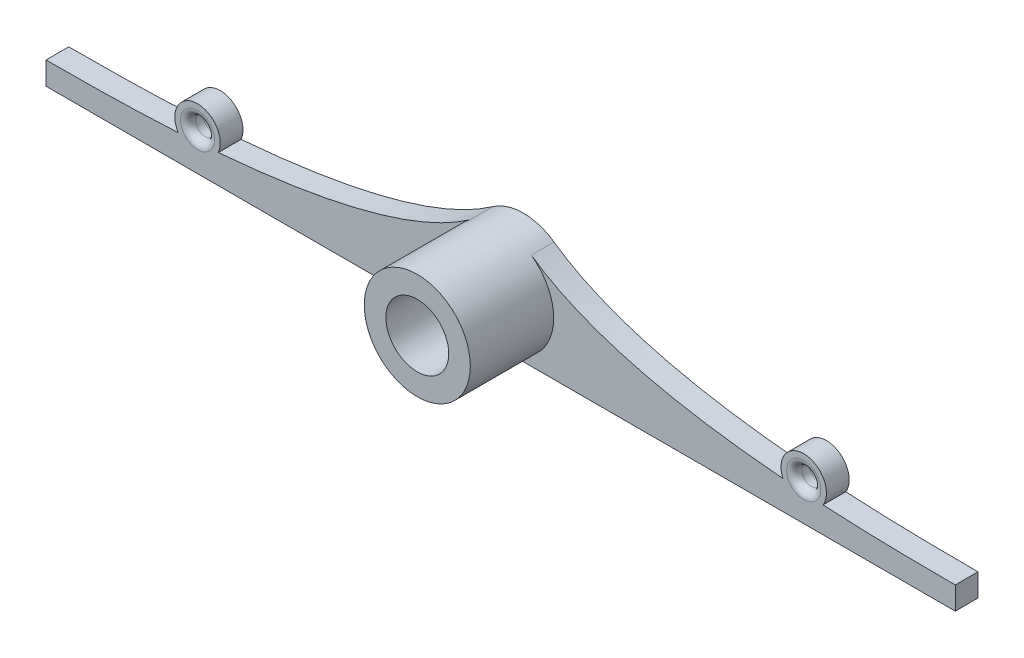
from build123d import *

# Parameters (mm, degrees)
SKETCH1_R             = 1.25
BOSS_EXTRUDE1_DEPTH   = 3
BOSS_EXTRUDE1_2_DEPTH = 3
SKETCH1_3_R           = 7
SKETCH1_3_R_2         = 4.15
BOSS_EXTRUDE2_DEPTH   = 14
FILLET1_R             = 1


with BuildPart() as part:
    # Sketch1 → Boss-Extrude1 (new body)
    with BuildSketch(Plane.XY):
        with BuildLine():
            Line((0, -7), (60, -7))
            Line((60, -7), (60, -4))
            add(Edge.make_bspline(
                [(60, -4), (55.163320485, -4), (49.053298786, -3.947636788), (42.55073288, -3.579164898)],
                knots=[0, 0, 0, 0, 0.318433517, 0.318433517, 0.318433517, 0.318433517], degree=3))
            ThreePointArc((42.55073288, -3.579164898), (40.208782774, 0.992726141), (37.254706676, -3.209696062))
            add(Edge.make_bspline(
                [(37.254706676, -3.209696062), (24.804076794, -2.167051335), (11.80488785, 0.231594042), (4.038655229, 5.717452574)],
                knots=[0.403779051, 0.403779051, 0.403779051, 0.403779051, 1, 1, 1, 1], degree=3))
            ThreePointArc((4.038655229, 5.717452574), (6.671662762, -2.118706207), (0, -7))
        make_face()
        with Locations((40, -2)):
            Circle(SKETCH1_R, mode=Mode.SUBTRACT)
    extrude(amount=BOSS_EXTRUDE1_DEPTH)



with BuildPart() as body_2:
    # Sketch1 → Boss-Extrude1 2 (new body)
    with BuildSketch(Plane.XY):
        with BuildLine():
            Line((-60, -7), (0, -7))
            ThreePointArc((0, -7), (-6.671662763, -2.118706204), (-4.038655225, 5.717452578))
            add(Edge.make_bspline(
                [(-37.254706671, -3.209696052), (-24.804076837, -2.16705132), (-11.80488784, 0.231594059), (-4.038655225, 5.717452578)],
                knots=[0.403779054, 0.403779054, 0.403779054, 0.403779054, 1, 1, 1, 1], degree=3))
            ThreePointArc((-37.254706671, -3.209696052), (-40.208782776, 0.992726141), (-42.550732884, -3.579164892))
            add(Edge.make_bspline(
                [(-60, -4), (-55.163320586, -4), (-49.053298864, -3.94763679), (-42.550732884, -3.579164892)],
                knots=[0, 0, 0, 0, 0.31843352, 0.31843352, 0.31843352, 0.31843352], degree=3))
            Line((-60, -4), (-60, -7))
        make_face()
        with Locations((-40, -2)):
            Circle(SKETCH1_R, mode=Mode.SUBTRACT)
    extrude(amount=BOSS_EXTRUDE1_2_DEPTH)


with BuildPart() as part_1:
    add(part.part)

    add(body_2.part)  # Boss-Extrude2 merges body 2
    # Sketch1<3> → Boss-Extrude2 (add)
    with BuildSketch(Plane.XY):
        Circle(SKETCH1_3_R)
        Circle(SKETCH1_3_R_2, mode=Mode.SUBTRACT)
    extrude(amount=BOSS_EXTRUDE2_DEPTH)

    # Fillet1
    fillet1_edges = [part_1.edges().sort_by_distance(p)[0] for p in [
        (38.75, -2, 3),
        (38.75, -2, 0),
        (-41.25, -2, 0),
        (-41.25, -2, 3),
    ]]
    fillet(fillet1_edges, radius=FILLET1_R)


solid = part_1.part
